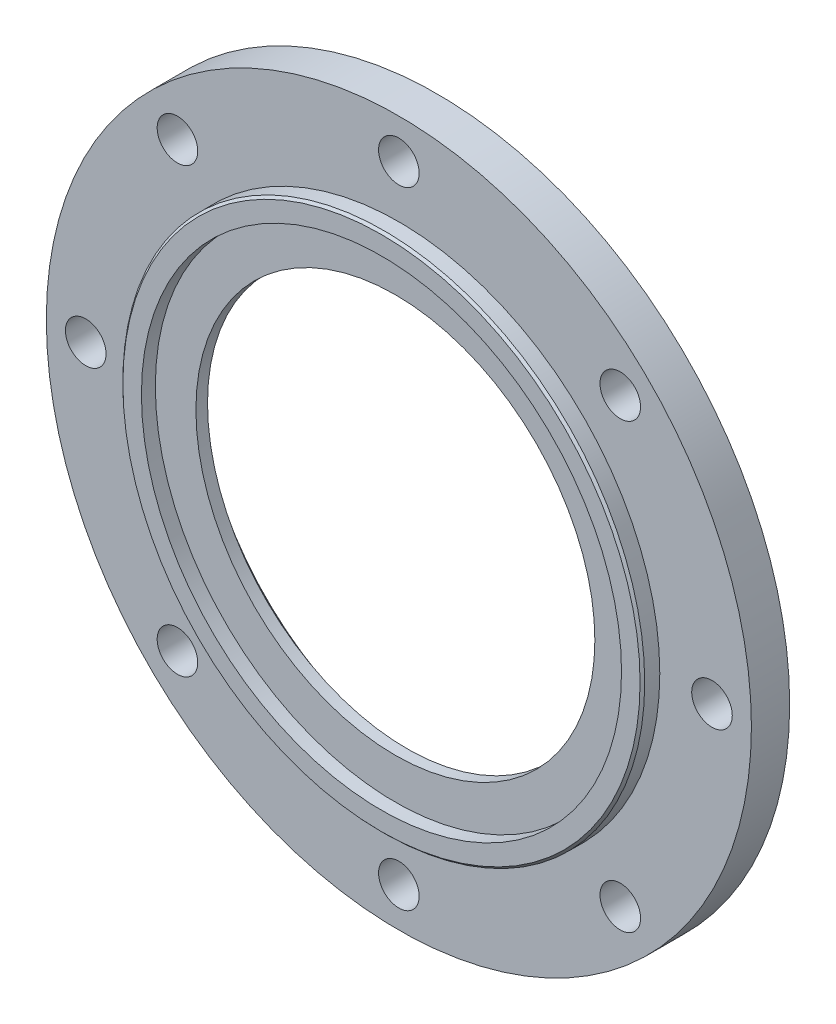
from build123d import *

# Parameters (mm, degrees)
SKETCH1_R           = 152
SKETCH1_R_2         = 86
BOSS_EXTRUDE3_DEPTH = 24
CUT_EXTRUDE6_START  = -7.5
SKETCH5_R           = 152
SKETCH5_R_2         = 112.5
CUT_EXTRUDE6_DEPTH  = 7.5
SKETCH6_R           = 103.5
CUT_EXTRUDE7_DEPTH  = 6
CHAMFER1_SIZE       = 1
SKETCH8_R           = 117
CUT_EXTRUDE8_DEPTH  = 2
SKETCH16_R          = 100
CUT_EXTRUDE9_DEPTH  = 11
CHAMFER3_SIZE       = 1
SKETCH19_R          = 4
CUT_EXTRUDE12_DEPTH = 11
CIRPATTERN1_COUNT   = 6
SKETCH3_R           = 8.75
CUT_EXTRUDE13_DEPTH = 217.296093354
CIRPATTERN2_COUNT   = 8


with BuildPart() as part:
    # Sketch1 → Boss-Extrude3 (new body)
    with BuildSketch(Plane.XY):
        Circle(SKETCH1_R)
        Circle(SKETCH1_R_2, mode=Mode.SUBTRACT)
    extrude(amount=BOSS_EXTRUDE3_DEPTH)

    # Sketch5 → Cut-Extrude6 (cut)
    with BuildSketch(Plane.XY.offset(24).offset(CUT_EXTRUDE6_START)):
        Circle(SKETCH5_R)
        Circle(SKETCH5_R_2, mode=Mode.SUBTRACT)
    extrude(amount=CUT_EXTRUDE6_DEPTH, mode=Mode.SUBTRACT)

    # Sketch6 → Cut-Extrude7 (cut)
    with BuildSketch(Plane.XY.offset(24)):
        Circle(SKETCH6_R)
    extrude(amount=-CUT_EXTRUDE7_DEPTH, mode=Mode.SUBTRACT)

    # Chamfer1
    chamfer1_edges = [part.edges().sort_by_distance(p)[0] for p in [
        (-112.5, 0, 24),
    ]]
    chamfer(chamfer1_edges, length=CHAMFER1_SIZE)

    # Sketch8 → Cut-Extrude8 (cut)
    with BuildSketch(Plane(origin=(0, 0, 0), x_dir=(-1, 0, 0), z_dir=(0, 0, -1))):
        Circle(SKETCH8_R)
    extrude(amount=-CUT_EXTRUDE8_DEPTH, mode=Mode.SUBTRACT)

    # Sketch16 → Cut-Extrude9 (cut)
    with BuildSketch(Plane(origin=(0, 0, 2), x_dir=(-1, 0, 0), z_dir=(0, 0, -1))):
        Circle(SKETCH16_R)
    extrude(amount=-CUT_EXTRUDE9_DEPTH, mode=Mode.SUBTRACT)

    # Chamfer3
    chamfer3_edges = [part.edges().sort_by_distance(p)[0] for p in [
        (100, 0, 2),
    ]]
    chamfer(chamfer3_edges, length=CHAMFER3_SIZE)

    # Sketch19 → Cut-Extrude12 (cut)
    with BuildSketch(Plane(origin=(0, 0, 2), x_dir=(-1, 0, 0), z_dir=(0, 0, -1))):
        with Locations((0, 107.5)):
            Circle(SKETCH19_R)
    cut_extrude12 = extrude(amount=-CUT_EXTRUDE12_DEPTH, mode=Mode.SUBTRACT)

    # CirPattern1: Cut-Extrude12 ×6 about axis
    cirpattern1_axis = Axis((0, 0, 0), (0, 0, 1))
    for i in range(1, CIRPATTERN1_COUNT):
        add(cut_extrude12.rotate(cirpattern1_axis, i * 360 / CIRPATTERN1_COUNT), mode=Mode.SUBTRACT)

    # Sketch3 → Cut-Extrude13 (cut, through all)
    with BuildSketch(Plane(origin=(0, 0, 0), x_dir=(-1, 0, 0), z_dir=(0, 0, -1))):
        with Locations((0, 135)):
            Circle(SKETCH3_R)
    cut_extrude13 = extrude(amount=-CUT_EXTRUDE13_DEPTH, mode=Mode.SUBTRACT)

    # CirPattern2: Cut-Extrude13 ×8 about axis
    cirpattern2_axis = Axis((0, 0, 0), (0, 0, 1))
    for i in range(1, CIRPATTERN2_COUNT):
        add(cut_extrude13.rotate(cirpattern2_axis, i * 360 / CIRPATTERN2_COUNT), mode=Mode.SUBTRACT)


solid = part.part
